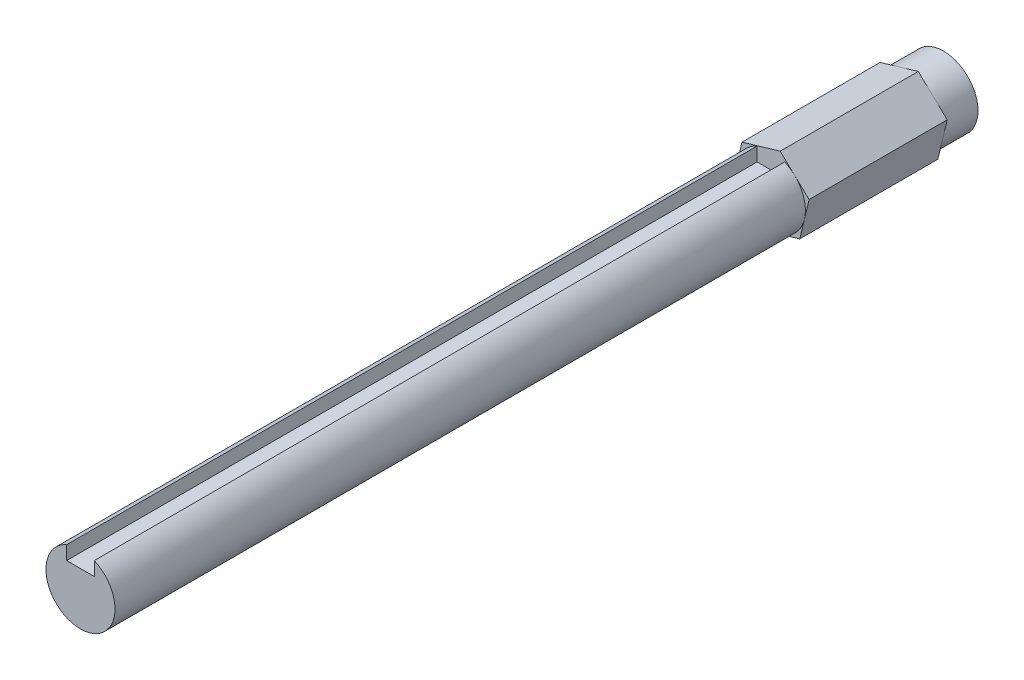
from build123d import *

# Parameters (mm, degrees)
EXTRUDE_1_DEPTH     = 20
SKETCH_2_R          = 5
EXTRUDE_2_DEPTH     = 5
EXTRUDE_START       = 100
SKETCH_7_R          = 5
EXTRUDE_4_DEPTH     = 100
SKETCH_8_W          = 4
SKETCH_8_H          = 3
CUT_EXTRUDE_1_DEPTH = 100


with BuildPart() as part:
    # 草图1 → 凸台-拉伸1 (new body)
    with BuildSketch(Plane.XY):
        Polygon((5.536193055, 1.63826121), (1.349320701, 5.613614431), (-4.186872353, 3.975353221), (-5.536193055, -1.63826121), (-1.349320701, -5.613614431), (4.186872353, -3.975353221), align=None)
    extrude(amount=EXTRUDE_1_DEPTH)

    # 草图2 → 凸台-拉伸2 (add)
    with BuildSketch(Plane(origin=(0, 0, 0), x_dir=(-1, 0, 0), z_dir=(0, 0, -1))):
        with Locations(Location((0, 0, 0), (0, 0, 193.51554681))):
            Circle(SKETCH_2_R)
    extrude(amount=EXTRUDE_2_DEPTH)

    # 草图7 → 凸台-拉伸4 (add)
    with BuildSketch(Plane.XY.offset(20).offset(EXTRUDE_START)):
        with Locations(Location((0, 0, 0), (0, 0, 346.48445319))):
            Circle(SKETCH_7_R)
    extrude(amount=-EXTRUDE_4_DEPTH)

    # 草图8 → 切除-拉伸1 (cut)
    with BuildSketch(Plane.XY.offset(120)):
        with Locations((0, 4.082575695)):
            Rectangle(SKETCH_8_W, SKETCH_8_H)
    extrude(amount=-CUT_EXTRUDE_1_DEPTH, mode=Mode.SUBTRACT)


solid = part.part
